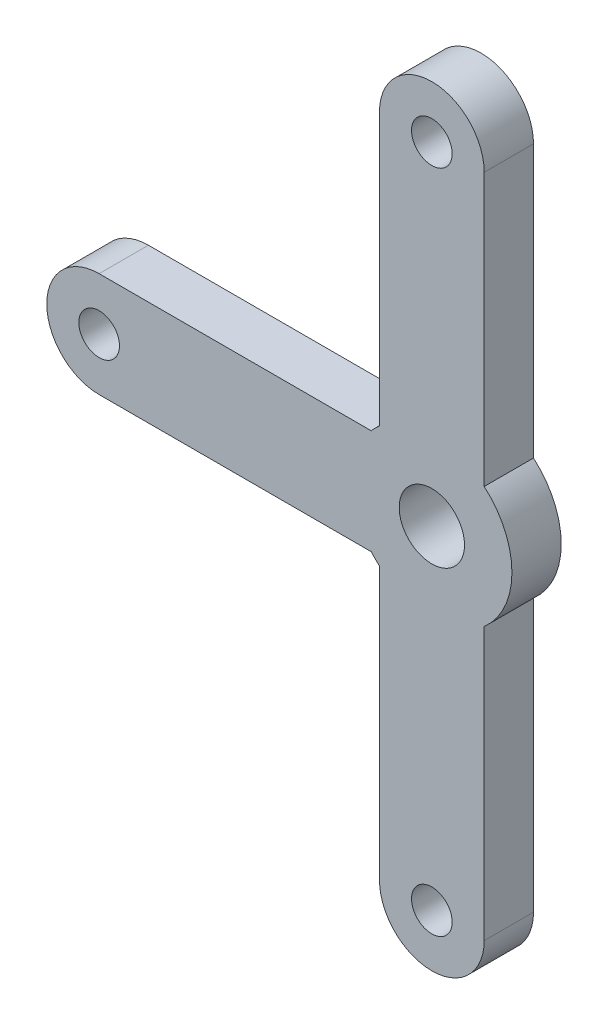
from build123d import *

# Parameters (mm, degrees)
S01_CENTRAL_SPINDLE_PAD_R         = 13
F_01_CENTRAL_SPINDLE_PAD_DEPTH    = 8
F_02_CAGE_RIB_1_DEPTH             = 8
F_03_CAGE_RIB_2_DEPTH             = 8
F_04_CAGE_RIB_3_DEPTH             = 8
F_05_START                        = -1
S05_THREE_CAGE_BOLT_HOLES_R       = 3.3
F_05_THREE_CAGE_BOLT_HOLES_DEPTH  = 10
F_06_START                        = -1
S06_SPINDLE_STEM_CLEARANCE_R      = 5.3
F_06_SPINDLE_STEM_CLEARANCE_DEPTH = 10


with BuildPart() as part:
    # S01 - Central spindle pad → 01 - Central spindle pad (new body)
    with BuildSketch(Plane.XY):
        Circle(S01_CENTRAL_SPINDLE_PAD_R)
    extrude(amount=F_01_CENTRAL_SPINDLE_PAD_DEPTH)

    # S02 - Cage rib 1 → 02 - Cage rib 1 (add)
    with BuildSketch(Plane.XY):
        with BuildLine():
            Line((-8.5, 0), (-8.5, 54))
            ThreePointArc((-8.5, 54), (0, 62.5), (8.5, 54))
            Line((8.5, 54), (8.5, 0))
            ThreePointArc((8.5, 0), (0, -8.5), (-8.5, 0))
        make_face()
    extrude(amount=F_02_CAGE_RIB_1_DEPTH)

    # S03 - Cage rib 2 → 03 - Cage rib 2 (add)
    with BuildSketch(Plane.XY):
        with BuildLine():
            Line((0, -8.5), (-54, -8.5))
            ThreePointArc((-54, -8.5), (-62.5, 0), (-54, 8.5))
            Line((-54, 8.5), (0, 8.5))
            ThreePointArc((0, 8.5), (8.5, 0), (0, -8.5))
        make_face()
    extrude(amount=F_03_CAGE_RIB_2_DEPTH)

    # S04 - Cage rib 3 → 04 - Cage rib 3 (add)
    with BuildSketch(Plane.XY):
        with BuildLine():
            Line((8.5, 0), (8.5, -54))
            ThreePointArc((8.5, -54), (0, -62.5), (-8.5, -54))
            Line((-8.5, -54), (-8.5, 0))
            ThreePointArc((-8.5, 0), (0, 8.5), (8.5, 0))
        make_face()
    extrude(amount=F_04_CAGE_RIB_3_DEPTH)

    # S05 - Three cage bolt holes → 05 - Three cage bolt holes (cut)
    with BuildSketch(Plane.XY.offset(F_05_START)):
        with Locations((0, 54)):
            Circle(S05_THREE_CAGE_BOLT_HOLES_R)
        with Locations((-54, 0)):
            Circle(S05_THREE_CAGE_BOLT_HOLES_R)
        with Locations((0, -54)):
            Circle(S05_THREE_CAGE_BOLT_HOLES_R)
    extrude(amount=F_05_THREE_CAGE_BOLT_HOLES_DEPTH, mode=Mode.SUBTRACT)

    # S06 - Spindle stem clearance → 06 - Spindle stem clearance (cut)
    with BuildSketch(Plane.XY.offset(F_06_START)):
        Circle(S06_SPINDLE_STEM_CLEARANCE_R)
    extrude(amount=F_06_SPINDLE_STEM_CLEARANCE_DEPTH, mode=Mode.SUBTRACT)


solid = part.part
